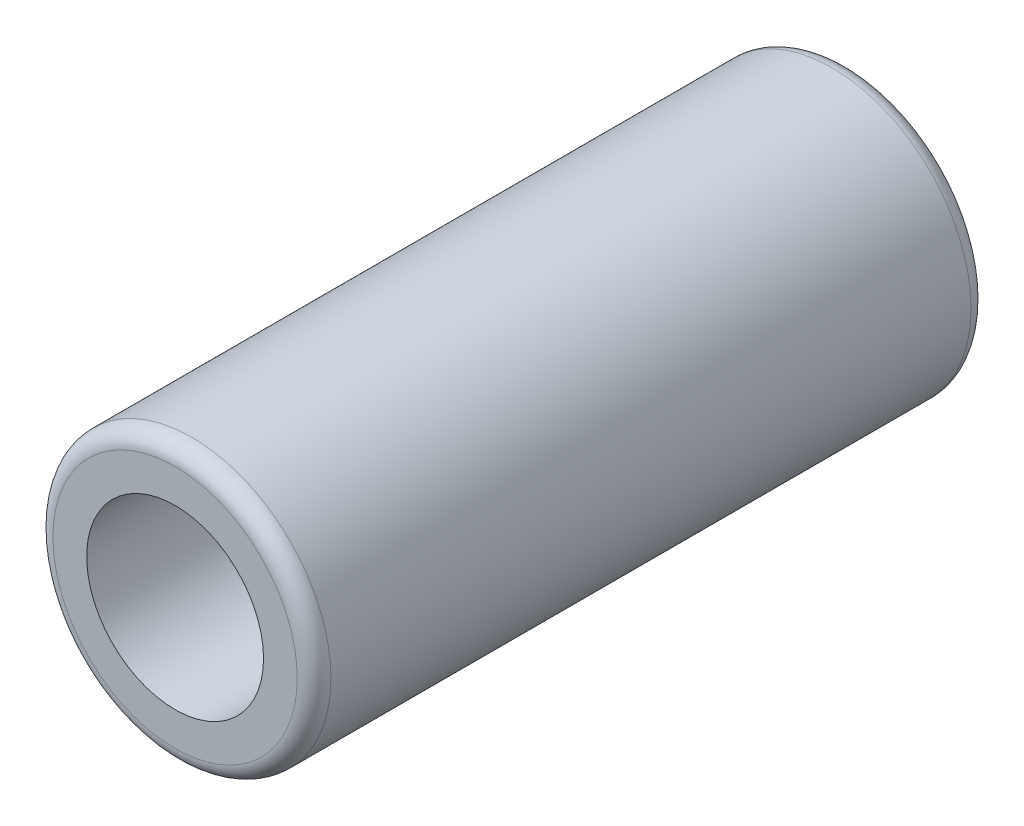
from build123d import *

# Parameters (mm, degrees)
SKICA1_R                = 8.25
SKICA1_R_2              = 5.25
P_IDAT_VYSUNUT_M1_DEPTH = 40
ZAOBLIT1_R              = 1


with BuildPart() as part:
    # Skica1 → Přidat vysunutím1 (new body)
    with BuildSketch(Plane.XY):
        Circle(SKICA1_R)
        Circle(SKICA1_R_2, mode=Mode.SUBTRACT)
    extrude(amount=P_IDAT_VYSUNUT_M1_DEPTH)

    # Zaoblit1
    zaoblit1_edges = [part.edges().sort_by_distance(p)[0] for p in [
        (-8.25, 0, 0),
        (-8.25, 0, 40),
    ]]
    fillet(zaoblit1_edges, radius=ZAOBLIT1_R)


solid = part.part
